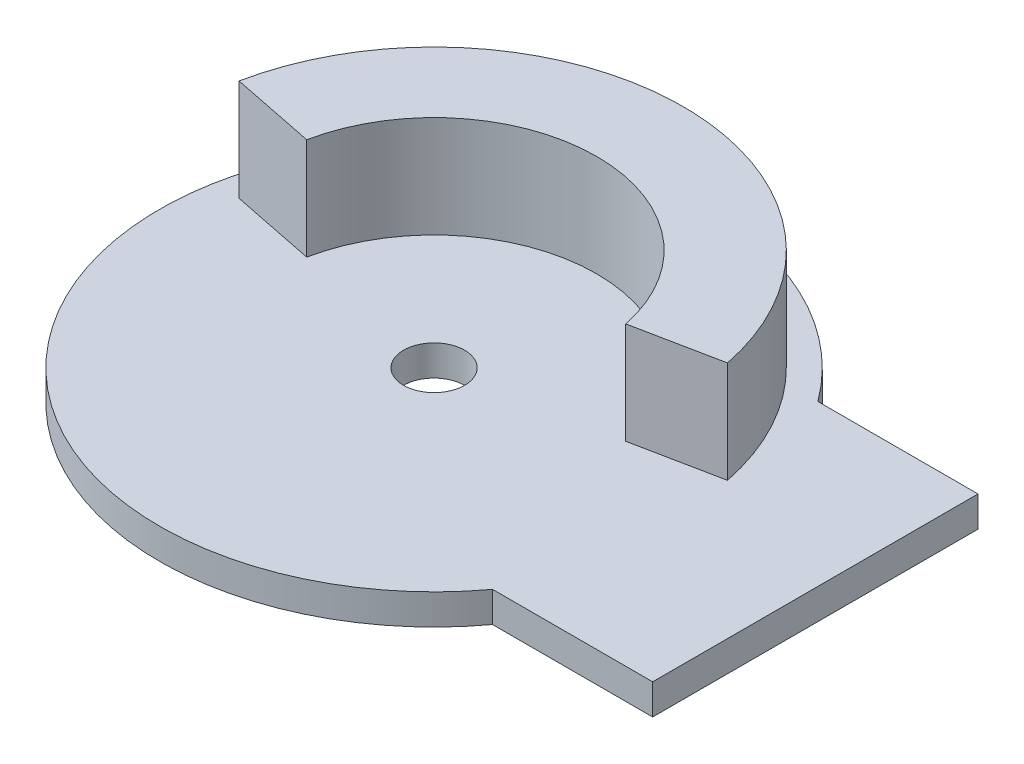
from build123d import *

# Parameters (mm, degrees)
BOSS_EXTRUDE1_DEPTH = 10
SKETCH2_R           = 3
BOSS_EXTRUDE2_DEPTH = 3


with BuildPart() as part:
    # Sketch1 → Boss-Extrude1 (new body)
    with BuildSketch(Plane(origin=(0, 0, 0), x_dir=(1, 0, 0), z_dir=(0, 1, 0))):
        with BuildLine():
            Line((-24.017268371, 4.839506173), (-15.684746691, 3.160493827))
            ThreePointArc((-15.684746691, 3.160493827), (0, 16), (15.684746691, 3.160493827))
            Line((15.684746691, 3.160493827), (24.017268371, 4.839506173))
            ThreePointArc((24.017268371, 4.839506173), (0, 24.5), (-24.017268371, 4.839506173))
        make_face()
    extrude(amount=BOSS_EXTRUDE1_DEPTH)

    # Sketch2 → Boss-Extrude2 (add)
    with BuildSketch(Plane.XZ):
        with BuildLine():
            Line((37.5, -16), (37.5, 16))
            Line((37.5, 16), (21.748563171, 16))
            ThreePointArc((21.748563171, 16), (12.186057607, 24.093567606), (0, 27))
            ThreePointArc((0, 27), (-27, 0), (0, -27))
            ThreePointArc((0, -27), (12.186057607, -24.093567606), (21.748563171, -16))
            Line((21.748563171, -16), (37.5, -16))
        make_face()
        Circle(SKETCH2_R, mode=Mode.SUBTRACT)
    extrude(amount=BOSS_EXTRUDE2_DEPTH)


solid = part.part
